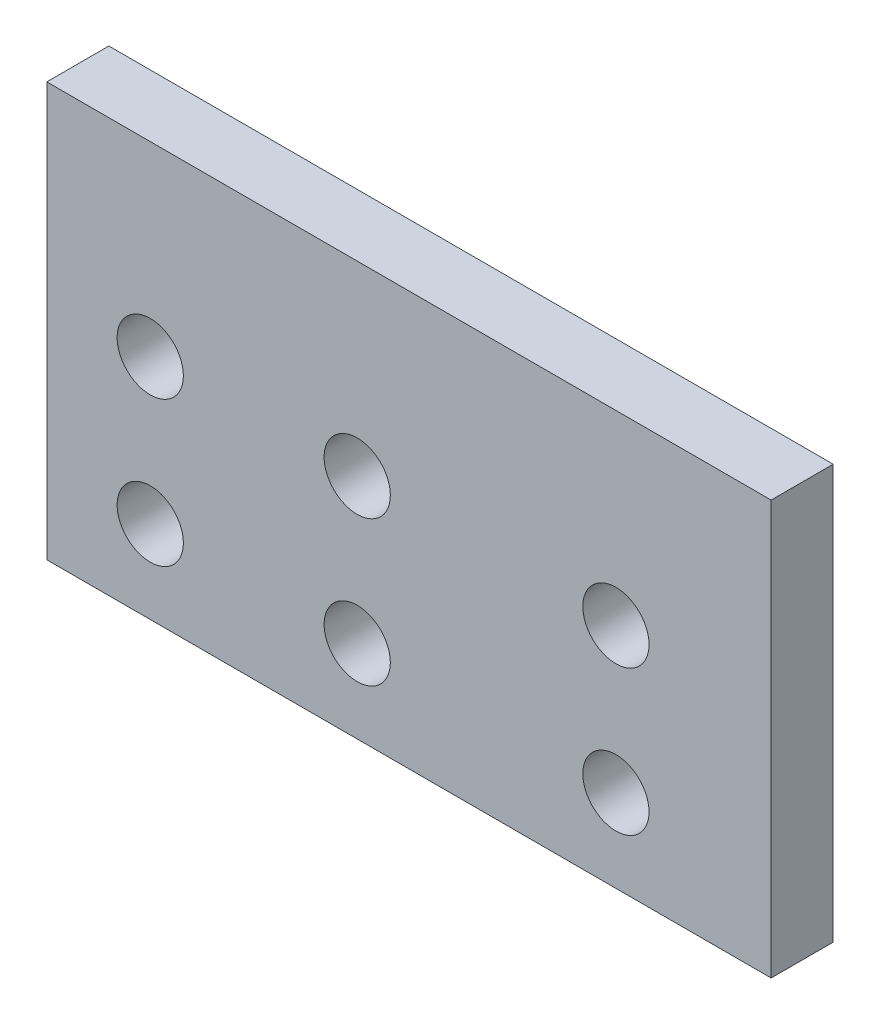
from build123d import *

# Parameters (mm, degrees)
SKETCH_1_W      = 35
SKETCH_1_H      = 20
SKETCH_1_R      = 1.6
EXTRUDE_1_DEPTH = 3


with BuildPart() as part:
    # 草图1 → 凸台-拉伸1 (new body)
    with BuildSketch(Plane.XY):
        Rectangle(SKETCH_1_W, SKETCH_1_H)
        with Locations((-12.5, 1)):
            Circle(SKETCH_1_R, mode=Mode.SUBTRACT)
        with Locations((-12.5, -6)):
            Circle(SKETCH_1_R, mode=Mode.SUBTRACT)
        with Locations((-2.5, 1)):
            Circle(SKETCH_1_R, mode=Mode.SUBTRACT)
        with Locations((-2.5, -6)):
            Circle(SKETCH_1_R, mode=Mode.SUBTRACT)
        with Locations((10, 1)):
            Circle(SKETCH_1_R, mode=Mode.SUBTRACT)
        with Locations((10, -6)):
            Circle(SKETCH_1_R, mode=Mode.SUBTRACT)
    extrude(amount=EXTRUDE_1_DEPTH)


solid = part.part
